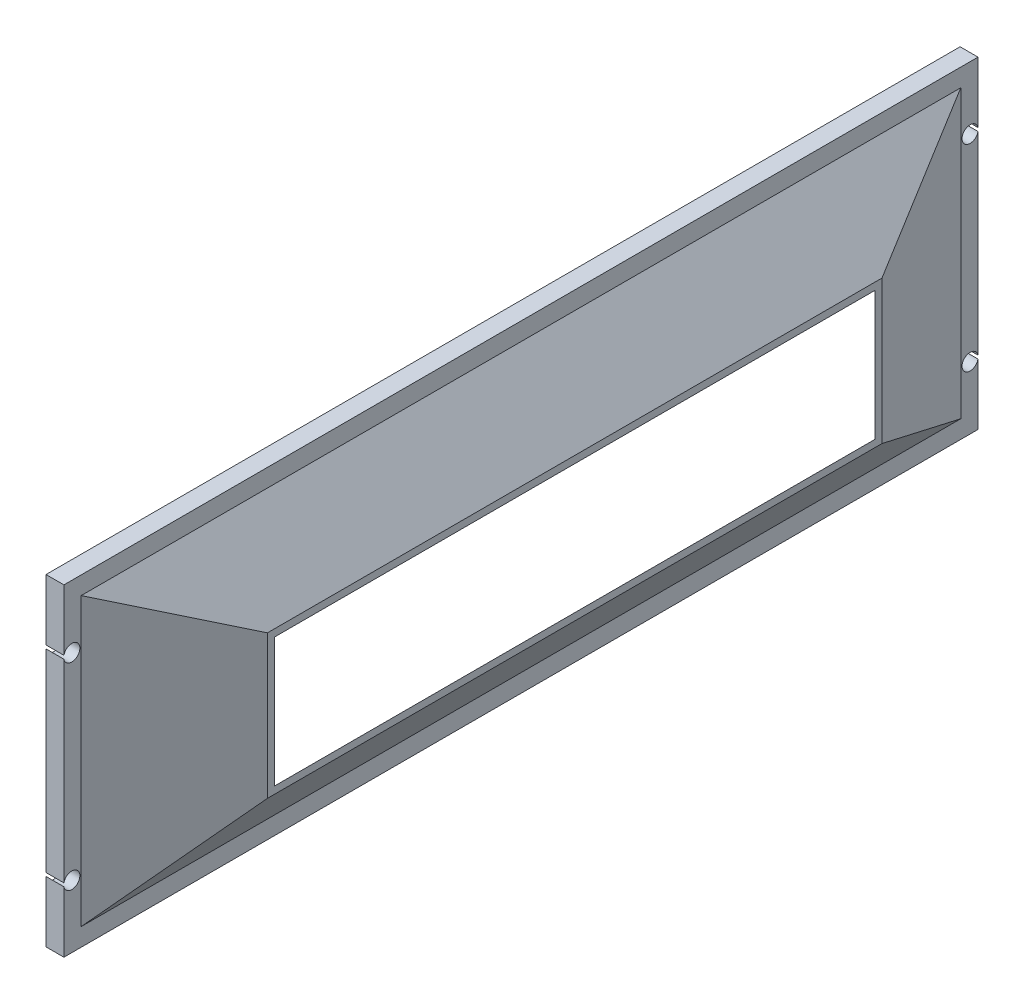
from build123d import *

# Parameters (mm, degrees)
SKETCH1_W            = 255.1
SKETCH1_H            = 90
SKETCH1_W_2          = 241.5
SKETCH1_H_2          = 76
BOSS_EXTRUDE1_DEPTH  = 5
BOSS_EXTRUDE2_DEPTH  = 78
BOSS_EXTRUDE3_DEPTH  = 2
BOSS_EXTRUDE4_DEPTH  = 241.5
CUT_EXTRUDE1_DEPTH   = 141
CUT_EXTRUDE2_DEPTH   = 141
M4_CLEARANCE_HOLE1_D = 4.5


with BuildPart() as part:
    # Sketch1 → Boss-Extrude1 (new body)
    with BuildSketch(Plane(origin=(0, 0, 0), x_dir=(0, 0, -1), z_dir=(1, 0, 0))):
        Rectangle(SKETCH1_W, SKETCH1_H)
        Rectangle(SKETCH1_W_2, SKETCH1_H_2, mode=Mode.SUBTRACT)
    extrude(amount=BOSS_EXTRUDE1_DEPTH)

    # Sketch3 → Boss-Extrude2 (add)
    with BuildSketch(Plane(origin=(0, -38, 0), x_dir=(1, 0, 0), z_dir=(0, 1, 0))):
        Polygon((5, 120.75), (20, 83.75), (20, 85.75), (5, 122.75), align=None)
    boss_extrude2 = extrude(amount=BOSS_EXTRUDE2_DEPTH)

    # Sketch6 → Boss-Extrude3 (add)
    with BuildSketch(Plane.XZ.offset(38)):
        Polygon((5, -122.75), (20, -85.75), (20, -83.75), (5, -120.75), align=None)
    boss_extrude3 = extrude(amount=BOSS_EXTRUDE3_DEPTH)

    # Mirror1: Boss-Extrude2, Boss-Extrude3 across plane
    add(boss_extrude2.mirror(Plane.XY))
    add(boss_extrude3.mirror(Plane.XY))

    # Sketch7 → Boss-Extrude4 (add)
    with BuildSketch(Plane.XY.offset(-120.75)):
        Polygon((5, 38), (20, 18), (20, 20), (5, 40), align=None)
        Polygon((5, -40), (5, -38), (20, -18), (20, -20), align=None)
    extrude(amount=BOSS_EXTRUDE4_DEPTH)

    # Sketch8 → Cut-Extrude1 (cut)
    with BuildSketch(Plane.XZ.offset(45)):
        Polygon((20, -120.75), (5.810810811, -120.75), (20, -85.75), align=None)
        Polygon((5.810810811, 120.75), (20, 120.75), (20, 85.75), align=None)
    extrude(amount=-CUT_EXTRUDE1_DEPTH, mode=Mode.SUBTRACT)

    # Sketch9 → Cut-Extrude2 (cut, symmetric)
    with BuildSketch(Plane.XY):
        Polygon((5, 40), (20, 20), (20, 40), align=None)
    cut_extrude2 = extrude(amount=CUT_EXTRUDE2_DEPTH, both=True, mode=Mode.SUBTRACT)

    # Mirror5: Cut-Extrude2 across plane
    add(cut_extrude2.mirror(Plane.ZX), mode=Mode.SUBTRACT)

    # M4 Clearance Hole1 (through all)
    with Locations(Plane(origin=(5, 0, 0), x_dir=(0, 0, -1), z_dir=(1, 0, 0))):
        with Locations((-125.35, 27.5), (-125.35, -27.5)):
            m4_clearance_hole1 = Hole(M4_CLEARANCE_HOLE1_D / 2)

    # Mirror6: M4 Clearance Hole1 across plane
    add(m4_clearance_hole1.mirror(Plane.XY), mode=Mode.SUBTRACT)


solid = part.part
